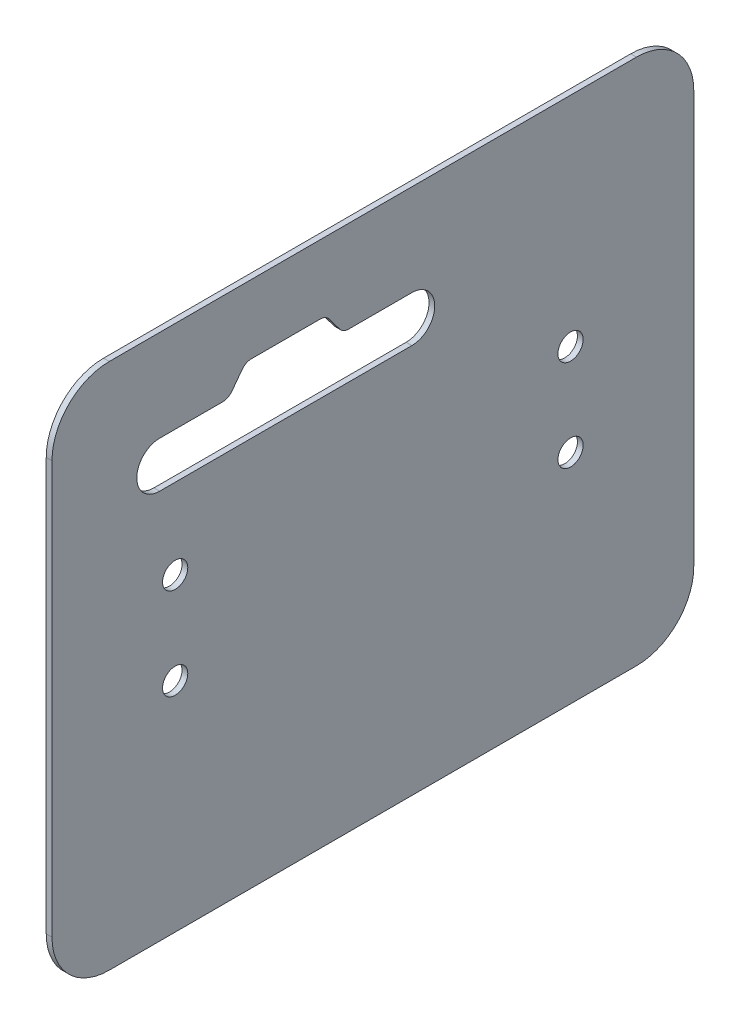
from build123d import *

# Parameters (mm, degrees)
SKETCH_1_R          = 1.1
EXTRUDE_1_DEPTH     = 0.5
CUT_EXTRUDE_1_DEPTH = 10
FILLET_1_R          = 1


with BuildPart() as part:
    # 草图1 → Extrude 1 (new body)
    with BuildSketch(Plane(origin=(0, 0, 0), x_dir=(0, 0, -1), z_dir=(1, 0, 0))):
        with BuildLine():
            Line((-23, 23), (23, 23))
            ThreePointArc((23, 23), (26.535533906, 21.535533906), (28, 18))
            Line((28, 18), (28, -18))
            ThreePointArc((28, -18), (26.535533906, -21.535533906), (23, -23))
            Line((23, -23), (-23, -23))
            ThreePointArc((-23, -23), (-26.535533906, -21.535533906), (-28, -18))
            Line((-28, -18), (-28, 18))
            ThreePointArc((-28, 18), (-26.535533906, 21.535533906), (-23, 23))
        make_face()
        with Locations((17.25, 4)):
            Circle(SKETCH_1_R, mode=Mode.SUBTRACT)
        with Locations((17.25, -4)):
            Circle(SKETCH_1_R, mode=Mode.SUBTRACT)
        with Locations((-17.25, -4)):
            Circle(SKETCH_1_R, mode=Mode.SUBTRACT)
        with Locations((-17.25, 4)):
            Circle(SKETCH_1_R, mode=Mode.SUBTRACT)
    extrude(amount=EXTRUDE_1_DEPTH)

    # 草图2 → 切除-拉伸1 (cut)
    with BuildSketch(Plane(origin=(0.5, 0, 0), x_dir=(0, 0, -1), z_dir=(1, 0, 0))):
        with BuildLine():
            Line((-18.6, 11), (3.4, 11))
            ThreePointArc((3.4, 11), (5.4, 13), (3.4, 15))
            Line((3.4, 15), (-18.6, 15))
            ThreePointArc((-18.6, 15), (-20.6, 13), (-18.6, 11))
        make_face()
        Polygon((-11.1, 17), (-12.6, 15), (-2.6, 15), (-4.1, 17), align=None)
    extrude(amount=-CUT_EXTRUDE_1_DEPTH, mode=Mode.SUBTRACT)

    # 圆角1
    fillet_1_edges = [part.edges().sort_by_distance(p)[0] for p in [
        (0.25, 15, 12.6),
        (0.25, 17, 11.1),
        (0.25, 17, 4.1),
        (0.25, 15, 2.6),
    ]]
    fillet(fillet_1_edges, radius=FILLET_1_R)


solid = part.part
